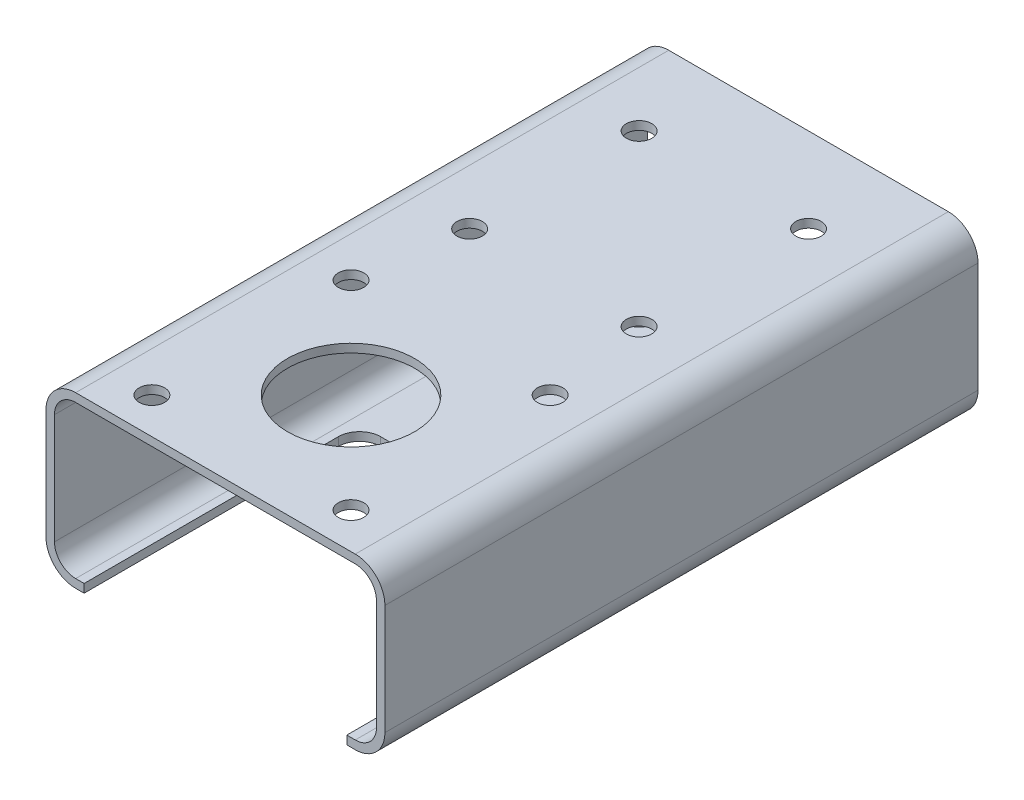
from build123d import *

# Parameters (mm, degrees)
AUFSATZ_LINEAR_AUSTRAGEN1_DEPTH = 140
SKIZZE2_R                       = 15
SCHNITT_LINEAR_AUSTRAGEN1_DEPTH = 10
SCHNITT_LINEAR_AUSTRAGEN2_DEPTH = 10
SKIZZE4_R                       = 3
SCHNITT_LINEAR_AUSTRAGEN3_DEPTH = 10
SKIZZE5_R                       = 3
SCHNITT_LINEAR_AUSTRAGEN4_DEPTH = 60


with BuildPart() as part:
    # Skizze1 → Aufsatz-Linear austragen1 (new body)
    with BuildSketch(Plane.XY):
        with BuildLine():
            Line((78, 5), (78, 31))
            ThreePointArc((78, 31), (75.949747468, 35.949747468), (71, 38))
            Line((71, 38), (5, 38))
            ThreePointArc((5, 38), (0.050252532, 35.949747468), (-2, 31))
            Line((-2, 31), (-2, 5))
            ThreePointArc((-2, 5), (0.050252532, 0.050252532), (5, -2))
            Line((5, -2), (71, -2))
            ThreePointArc((71, -2), (75.949747468, 0.050252532), (78, 5))
        make_face()
        with BuildLine():
            Line((0, 31), (0, 5))
            ThreePointArc((0, 5), (1.464466094, 1.464466094), (5, 0))
            Line((5, 0), (71, 0))
            ThreePointArc((71, 0), (74.535533906, 1.464466094), (76, 5))
            Line((76, 5), (76, 31))
            ThreePointArc((76, 31), (74.535533906, 34.535533906), (71, 36))
            Line((71, 36), (5, 36))
            ThreePointArc((5, 36), (1.464466094, 34.535533906), (0, 31))
        make_face(mode=Mode.SUBTRACT)
    extrude(amount=AUFSATZ_LINEAR_AUSTRAGEN1_DEPTH)

    # Skizze2 → Schnitt-Linear austragen1 (cut)
    with BuildSketch(Plane(origin=(0, 38, 0), x_dir=(-1, 0, 0), z_dir=(0, 1, 0))):
        with Locations(Location((-38, 108, 0), (0, 0, 90))):
            Circle(SKIZZE2_R)
    extrude(amount=-SCHNITT_LINEAR_AUSTRAGEN1_DEPTH, mode=Mode.SUBTRACT)

    # Skizze3 → Schnitt-Linear austragen2 (cut)
    with BuildSketch(Plane.XZ.offset(2)):
        with BuildLine():
            Line((7, 140), (69, 140))
            Line((69, 140), (69, 80))
            ThreePointArc((69, 80), (67.535533906, 76.464466094), (64, 75))
            Line((64, 75), (12, 75))
            ThreePointArc((12, 75), (8.464466094, 76.464466094), (7, 80))
            Line((7, 80), (7, 140))
        make_face()
    extrude(amount=-SCHNITT_LINEAR_AUSTRAGEN2_DEPTH, mode=Mode.SUBTRACT)

    # Skizze4 → Schnitt-Linear austragen3 (cut)
    with BuildSketch(Plane(origin=(0, 38, 0), x_dir=(1, 0, 0), z_dir=(0, 1, 0))):
        with Locations(Location((61.5, -84.5, 0), (0, 0, 270))):
            Circle(SKIZZE4_R)
        with Locations((14.5, -84.5)):
            Circle(SKIZZE4_R)
        with Locations(Location((14.5, -131.5, 0), (0, 0, 270))):
            Circle(SKIZZE4_R)
        with Locations((61.5, -131.5)):
            Circle(SKIZZE4_R)
    extrude(amount=-SCHNITT_LINEAR_AUSTRAGEN3_DEPTH, mode=Mode.SUBTRACT)

    # Skizze5 → Schnitt-Linear austragen4 (cut)
    with BuildSketch(Plane(origin=(0, 38, 0), x_dir=(1, 0, 0), z_dir=(0, 1, 0))):
        with Locations(Location((58, -20, 0), (0, 0, 180))):
            Circle(SKIZZE5_R)
        with Locations(Location((18, -20, 0), (0, 0, 180))):
            Circle(SKIZZE5_R)
        with Locations(Location((58, -60, 0), (0, 0, 180))):
            Circle(SKIZZE5_R)
        with Locations(Location((18, -60, 0), (0, 0, 180))):
            Circle(SKIZZE5_R)
    extrude(amount=-SCHNITT_LINEAR_AUSTRAGEN4_DEPTH, mode=Mode.SUBTRACT)


solid = part.part
